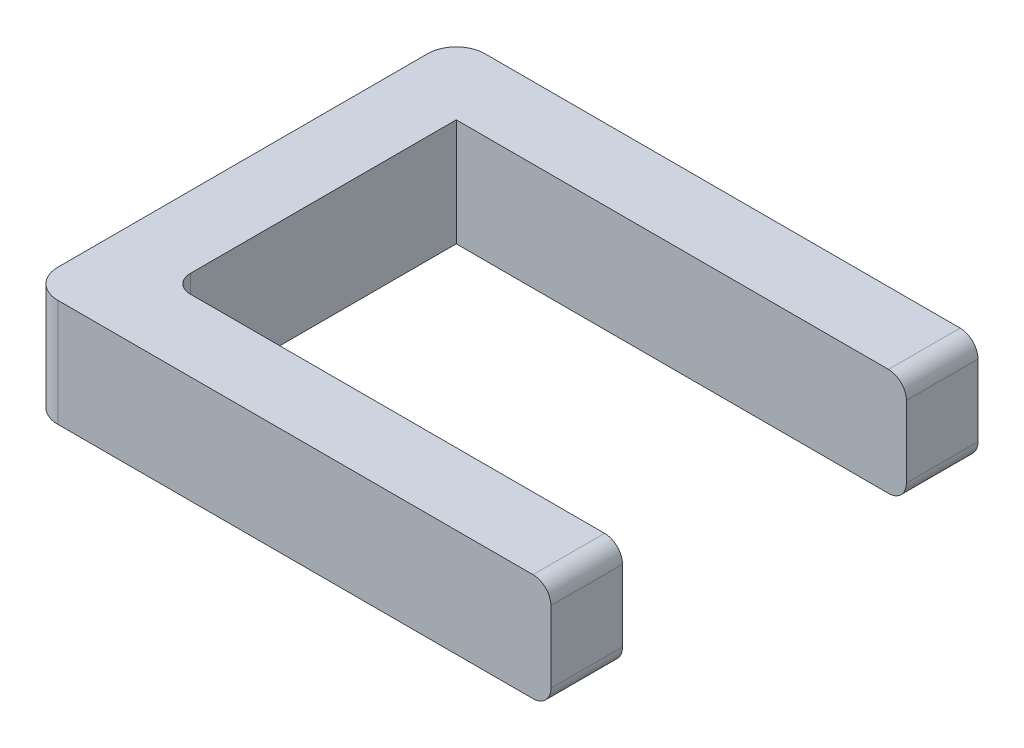
from build123d import *

# Parameters (mm, degrees)
EXTRUDE4_DEPTH       = 38.1
FILLET1_R            = 6.35
FILLET2_R            = 10.16
FILLET2_OF_MIRROR1_R = 10.16
FILLET4_R            = 6.35


with BuildPart() as part:
    # Sketch4 → Extrude4 (new body)
    with BuildSketch(Plane(origin=(0, 0, 0), x_dir=(1, 0, 0), z_dir=(0, 1, 0))):
        Polygon((-25.4, -25.4), (159.67622317, -25.4), (159.67622317, 0), (0, 0), (0, 50.356184866), (-25.4, 50.356184866), align=None)
    extrude4 = extrude(amount=-EXTRUDE4_DEPTH)

    # Fillet1
    fillet1_edges = [part.edges().sort_by_distance(p)[0] for p in [
        (0, -19.05, 0),
        (159.67622317, -38.1, 12.7),
        (159.67622317, 0, 12.7),
    ]]
    fillet(fillet1_edges, radius=FILLET1_R)

    # Fillet2
    fillet2_edges = [part.edges().sort_by_distance(p)[0] for p in [
        (-25.4, -19.05, 25.4),
    ]]
    fillet(fillet2_edges, radius=FILLET2_R)

    # Mirror1: Extrude4 across plane
    add(extrude4.mirror(Plane(origin=(-25.4, -38.1, -50.356184866), x_dir=(1, 0, 0), z_dir=(0, 0, -1))))

    # Fillet2 of Mirror1
    fillet2_of_mirror1_edges = [part.edges().sort_by_distance(p)[0] for p in [
        (-25.4, -19.05, -126.112369731),
    ]]
    fillet(fillet2_of_mirror1_edges, radius=FILLET2_OF_MIRROR1_R)

    # Fillet4
    fillet4_edges = [part.edges().sort_by_distance(p)[0] for p in [
        (159.67622317, 0, -113.412369731),
        (159.67622317, -38.1, -113.412369731),
    ]]
    fillet(fillet4_edges, radius=FILLET4_R)


solid = part.part
